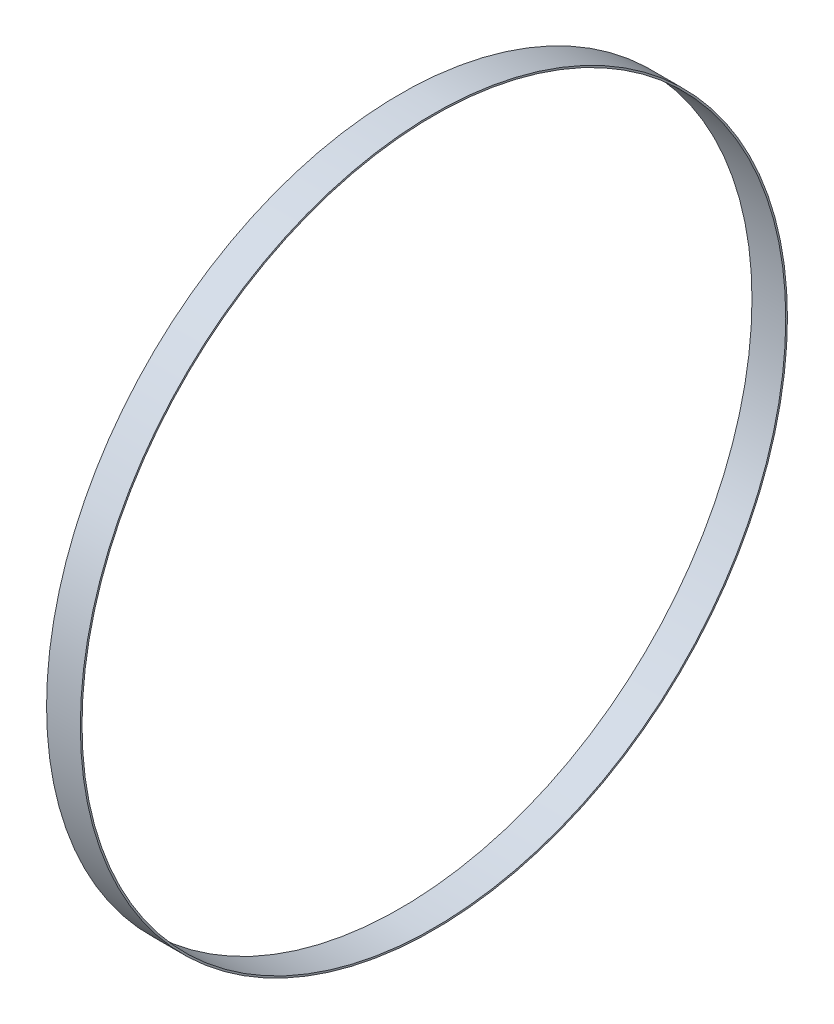
from build123d import *

# Parameters (mm, degrees)
SKETCH1_R           = 1047
SKETCH1_R_2         = 1042
BOSS_EXTRUDE1_DEPTH = 100


with BuildPart() as part:
    # Sketch1 → Boss-Extrude1 (new body)
    with BuildSketch(Plane(origin=(0, 0, 0), x_dir=(0, 0, -1), z_dir=(1, 0, 0))):
        Circle(SKETCH1_R)
        Circle(SKETCH1_R_2, mode=Mode.SUBTRACT)
    extrude(amount=BOSS_EXTRUDE1_DEPTH)


solid = part.part
